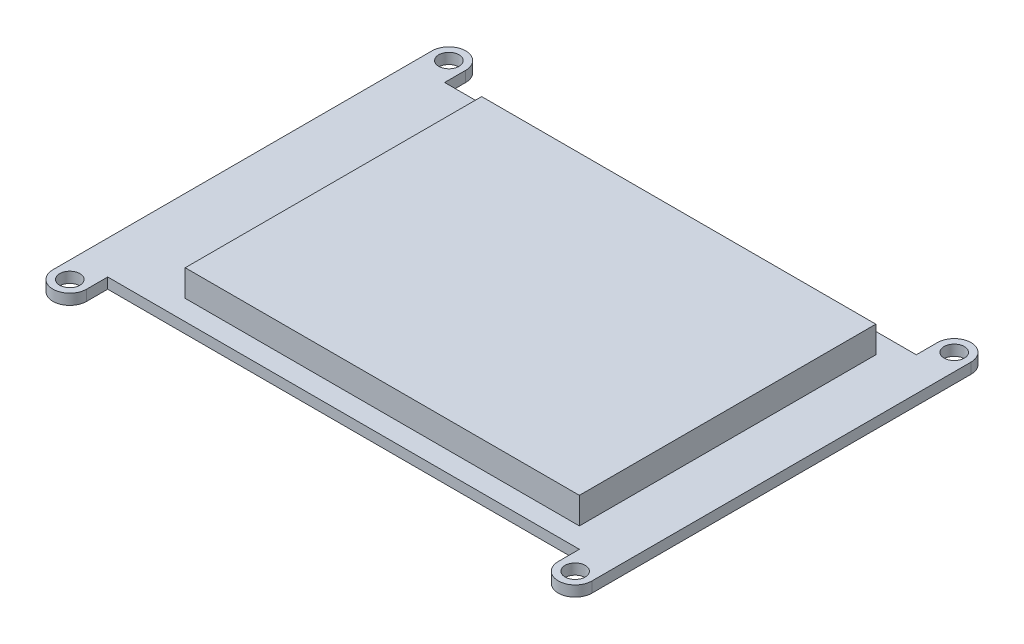
from build123d import *

# Parameters (mm, degrees)
Y_PCB_EXTR_DEPTH                = 1.6
SKETCH1_5_R                     = 1.524
Z0X0_CORNER_EXTR_DEPTH          = 1.6
SKETCH1_6_R                     = 1.524
Z0X_CORNER_EXTR_DEPTH           = 1.6
SKETCH1_7_R                     = 1.524
Z_X0_CORNER_EXTR_DEPTH          = 1.6
SKETCH1_8_R                     = 1.524
Z_X_CORNER_EXTR_DEPTH           = 1.6
Y_DISPLAY_EXTR_DEPTH            = 5.6
SKETCH1_11_W                    = 11.43
SKETCH1_11_H                    = 13.952
Y_DISPLAY_EXTR_BEHIND_USD_DEPTH = 5.6
SKETCH1_12_W                    = 11.43
SKETCH1_12_H                    = 3.048
Y_USD_EXTR_OUTER_EDGE_DEPTH     = 1.6
SKETCH1_13_W                    = 11.43
SKETCH1_13_H                    = 13.952
Y_USD_EXTR_DEPTH                = 2
SKETCH1_14_W                    = 11.43
SKETCH1_14_H                    = 3.048
Y_USD_EXTR_OUTER_BOTTOM_DEPTH   = 2


with BuildPart() as part:
    # Sketch1 → Y+ PCB extr (new body)
    with BuildSketch(Plane(origin=(0, 0, 0), x_dir=(1, 0, 0), z_dir=(0, 1, 0))):
        Polygon((81.28, 50.8), (76.2, 50.8), (66.167, 50.8), (66.167, 47.752), (73.152, 47.752), (73.152, 3.048), (13.716, 3.048), (13.716, 47.752), (54.737, 47.752), (54.737, 50.8), (5.08, 50.8), (0, 50.8), (0, 0), (5.08, 0), (76.2, 0), (81.28, 0), align=None)
    extrude(amount=Y_PCB_EXTR_DEPTH)

    # Sketch1<5> → Z0X0 corner extr (add)
    with BuildSketch(Plane(origin=(0, 0, 0), x_dir=(1, 0, 0), z_dir=(0, 1, 0))):
        with BuildLine():
            Line((0, 50.8), (5.08, 50.8))
            Line((5.08, 50.8), (5.08, 53.98))
            ThreePointArc((5.08, 53.98), (2.54, 56.52), (0, 53.98))
            Line((0, 53.98), (0, 50.8))
        make_face()
        with Locations((2.54, 53.98)):
            Circle(SKETCH1_5_R, mode=Mode.SUBTRACT)
    extrude(amount=Z0X0_CORNER_EXTR_DEPTH)

    # Sketch1<6> → Z0X+ corner extr (add)
    with BuildSketch(Plane(origin=(0, 0, 0), x_dir=(1, 0, 0), z_dir=(0, 1, 0))):
        with BuildLine():
            Line((76.2, 53.98), (76.2, 50.8))
            Line((76.2, 50.8), (81.28, 50.8))
            Line((81.28, 50.8), (81.28, 53.98))
            ThreePointArc((81.28, 53.98), (78.74, 56.52), (76.2, 53.98))
        make_face()
        with Locations((78.74, 53.98)):
            Circle(SKETCH1_6_R, mode=Mode.SUBTRACT)
    extrude(amount=Z0X_CORNER_EXTR_DEPTH)

    # Sketch1<7> → Z+X0 corner extr (add)
    with BuildSketch(Plane(origin=(0, 0, 0), x_dir=(1, 0, 0), z_dir=(0, 1, 0))):
        with BuildLine():
            Line((5.08, -3.18), (5.08, 0))
            Line((5.08, 0), (0, 0))
            Line((0, 0), (0, -3.18))
            ThreePointArc((0, -3.18), (2.54, -5.72), (5.08, -3.18))
        make_face()
        with Locations((2.54, -3.18)):
            Circle(SKETCH1_7_R, mode=Mode.SUBTRACT)
    extrude(amount=Z_X0_CORNER_EXTR_DEPTH)

    # Sketch1<8> → Z+X+ corner extr (add)
    with BuildSketch(Plane(origin=(0, 0, 0), x_dir=(1, 0, 0), z_dir=(0, 1, 0))):
        with BuildLine():
            Line((81.28, -3.18), (81.28, 0))
            Line((81.28, 0), (76.2, 0))
            Line((76.2, 0), (76.2, -3.18))
            ThreePointArc((76.2, -3.18), (78.74, -5.72), (81.28, -3.18))
        make_face()
        with Locations((78.74, -3.18)):
            Circle(SKETCH1_8_R, mode=Mode.SUBTRACT)
    extrude(amount=Z_X_CORNER_EXTR_DEPTH)

    # Sketch1<10> → Y+ display extr (add)
    with BuildSketch(Plane(origin=(0, 0, 0), x_dir=(1, 0, 0), z_dir=(0, 1, 0))):
        Polygon((73.152, 47.752), (66.167, 47.752), (66.167, 33.8), (54.737, 33.8), (54.737, 47.752), (13.716, 47.752), (13.716, 3.048), (73.152, 3.048), align=None)
    extrude(amount=Y_DISPLAY_EXTR_DEPTH)

    # Sketch1<11> → Y+ display extr behind uSD (add)
    with BuildSketch(Plane(origin=(0, 0, 0), x_dir=(1, 0, 0), z_dir=(0, 1, 0))):
        with Locations((60.452, 40.776)):
            Rectangle(SKETCH1_11_W, SKETCH1_11_H)
    extrude(amount=Y_DISPLAY_EXTR_BEHIND_USD_DEPTH)

    # Sketch1<12> → Y- uSD extr outer edge (add)
    with BuildSketch(Plane(origin=(0, 0, 0), x_dir=(1, 0, 0), z_dir=(0, 1, 0))):
        with Locations((60.452, 49.276)):
            Rectangle(SKETCH1_12_W, SKETCH1_12_H)
    extrude(amount=Y_USD_EXTR_OUTER_EDGE_DEPTH)

    # Sketch1<13> → Y- uSD extr (add)
    with BuildSketch(Plane(origin=(0, 0, 0), x_dir=(1, 0, 0), z_dir=(0, 1, 0))):
        with Locations((60.452, 40.776)):
            Rectangle(SKETCH1_13_W, SKETCH1_13_H)
    extrude(amount=-Y_USD_EXTR_DEPTH)

    # Sketch1<14> → Y- uSD extr outer bottom (add)
    with BuildSketch(Plane(origin=(0, 0, 0), x_dir=(1, 0, 0), z_dir=(0, 1, 0))):
        with Locations((60.452, 49.276)):
            Rectangle(SKETCH1_14_W, SKETCH1_14_H)
    extrude(amount=-Y_USD_EXTR_OUTER_BOTTOM_DEPTH)


solid = part.part
